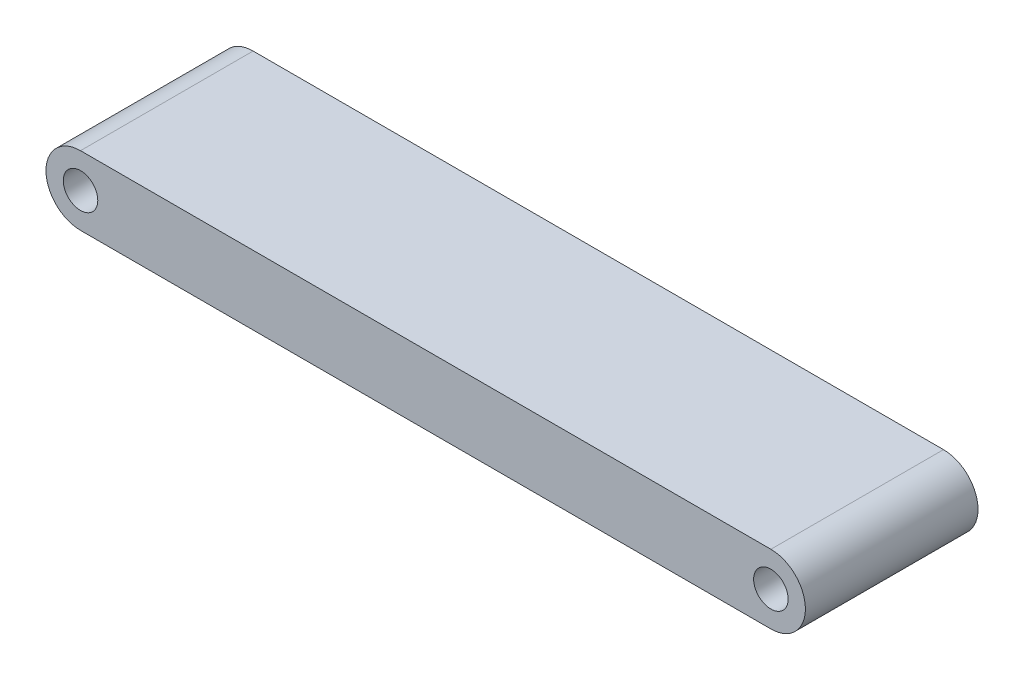
from build123d import *

# Parameters (mm, degrees)
EXTRUDE_1_DEPTH = 1000


with BuildPart() as part:
    # ｽｹｯﾁ1 → ﾎﾞｽ - 押し出し1 (new body)
    with BuildSketch(Plane.XY):
        with BuildLine():
            ThreePointArc((-2000, 200), (-2200, 0), (-2000, -200))
            Line((-2000, -200), (-2000, -100))
            ThreePointArc((-2000, -100), (-2100, 0), (-2000, 100))
            Line((-2000, 100), (-2000, 200))
        make_face()
        with BuildLine():
            Line((-2000, -100), (-2000, -200))
            ThreePointArc((-2000, -200), (-1858.578643763, -141.421356237), (-1800, 0))
            ThreePointArc((-1800, 0), (-1858.578643763, 141.421356237), (-2000, 200))
            Line((-2000, 200), (-2000, 100))
            ThreePointArc((-2000, 100), (-1929.289321881, 70.710678119), (-1900, 0))
            ThreePointArc((-1900, 0), (-1929.289321881, -70.710678119), (-2000, -100))
        make_face()
        with BuildLine():
            ThreePointArc((-1800, 0), (-1858.578643763, -141.421356237), (-2000, -200))
            Line((-2000, -200), (2000, -200))
            ThreePointArc((2000, -200), (1800, 0), (2000, 200))
            Line((2000, 200), (-2000, 200))
            ThreePointArc((-2000, 200), (-1858.578643763, 141.421356237), (-1800, 0))
        make_face()
        with BuildLine():
            ThreePointArc((2000, 200), (1800, 0), (2000, -200))
            Line((2000, -200), (2000, -100))
            ThreePointArc((2000, -100), (1900, 0), (2000, 100))
            Line((2000, 100), (2000, 200))
        make_face()
        with BuildLine():
            Line((2000, -100), (2000, -200))
            ThreePointArc((2000, -200), (2141.421356237, -141.421356237), (2200, 0))
            ThreePointArc((2200, 0), (2141.421356237, 141.421356237), (2000, 200))
            Line((2000, 200), (2000, 100))
            ThreePointArc((2000, 100), (2070.710678119, 70.710678119), (2100, 0))
            ThreePointArc((2100, 0), (2070.710678119, -70.710678119), (2000, -100))
        make_face()
    extrude(amount=EXTRUDE_1_DEPTH)


solid = part.part
